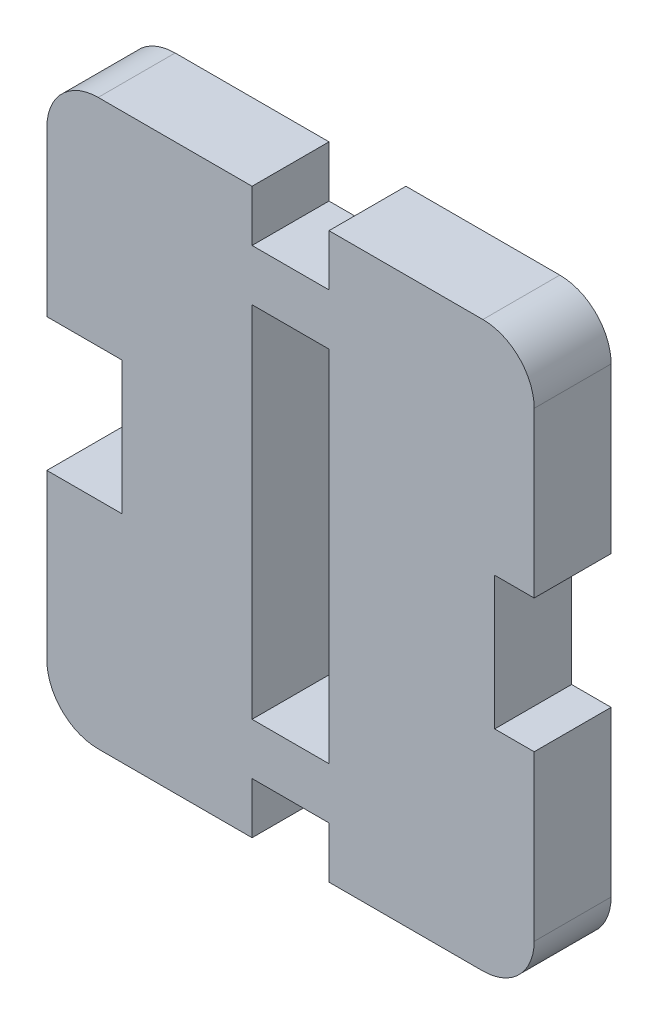
from build123d import *

# Parameters (mm, degrees)
SKETCH1_W          = 3
SKETCH1_H          = 14
BASE_EXTRUDE_DEPTH = 3


with BuildPart() as part:
    # Sketch1 → Base-Extrude (new body)
    with BuildSketch(Plane.XY):
        with BuildLine():
            Line((-1033.116910611, 53.997744838), (-1033.116910611, 47.593073912))
            Line((-1033.116910611, 47.593073912), (-1034.65769353, 47.593073912))
            Line((-1034.65769353, 47.593073912), (-1034.65769353, 42.402415763))
            Line((-1034.65769353, 42.402415763), (-1033.116910611, 42.402415763))
            Line((-1033.116910611, 42.402415763), (-1033.116910611, 35.997744838))
            ThreePointArc((-1033.116910611, 35.997744838), (-1033.702697049, 34.583531275), (-1035.116910611, 33.997744838))
            Line((-1035.116910611, 33.997744838), (-1041.116910611, 33.997744838))
            Line((-1041.116910611, 33.997744838), (-1041.116910611, 35.997744838))
            Line((-1041.116910611, 35.997744838), (-1042.616910611, 35.997744838))
            Line((-1042.616910611, 35.997744838), (-1044.116910611, 35.997744838))
            Line((-1044.116910611, 35.997744838), (-1044.116910611, 33.997744838))
            Line((-1044.116910611, 33.997744838), (-1050.116910611, 33.997744838))
            ThreePointArc((-1050.116910611, 33.997744838), (-1051.531124173, 34.583531275), (-1052.116910611, 35.997744838))
            Line((-1052.116910611, 35.997744838), (-1052.116910611, 42.402415763))
            Line((-1052.116910611, 42.402415763), (-1049.190418334, 42.402415763))
            Line((-1049.190418334, 42.402415763), (-1049.190418334, 47.593073912))
            Line((-1049.190418334, 47.593073912), (-1052.116910611, 47.593073912))
            Line((-1052.116910611, 47.593073912), (-1052.116910611, 53.997744838))
            ThreePointArc((-1052.116910611, 53.997744838), (-1051.531124173, 55.4119584), (-1050.116910611, 55.997744838))
            Line((-1050.116910611, 55.997744838), (-1044.116910611, 55.997744838))
            Line((-1044.116910611, 55.997744838), (-1044.116910611, 53.997744838))
            Line((-1044.116910611, 53.997744838), (-1042.616910611, 53.997744838))
            Line((-1042.616910611, 53.997744838), (-1041.116910611, 53.997744838))
            Line((-1041.116910611, 53.997744838), (-1041.116910611, 55.997744838))
            Line((-1041.116910611, 55.997744838), (-1035.116910611, 55.997744838))
            ThreePointArc((-1035.116910611, 55.997744838), (-1033.702697049, 55.4119584), (-1033.116910611, 53.997744838))
        make_face()
        with Locations((-1042.616910611, 44.997744838)):
            Rectangle(SKETCH1_W, SKETCH1_H, mode=Mode.SUBTRACT)
    extrude(amount=BASE_EXTRUDE_DEPTH)


solid = part.part
